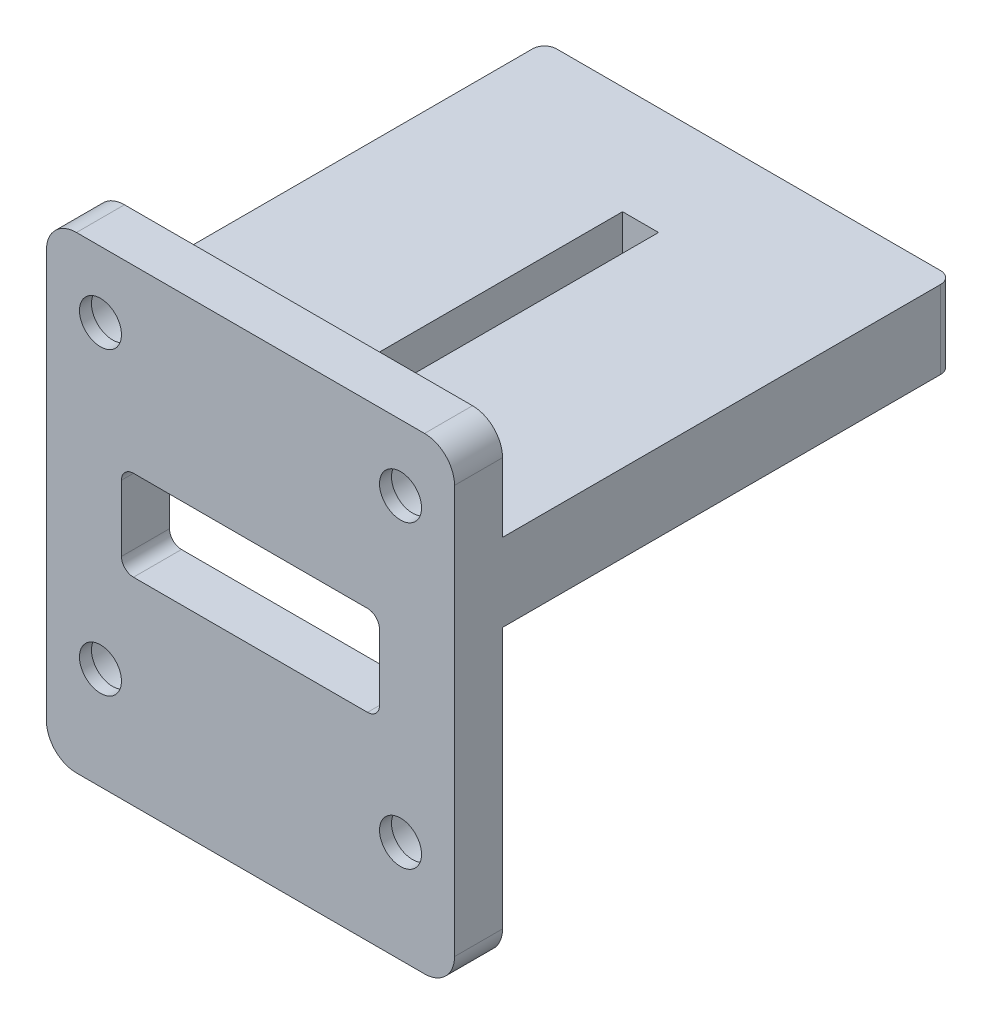
from build123d import *

# Parameters (mm, degrees)
SKETCH1_W           = 68
SKETCH1_H           = 78
BOSS_EXTRUDE1_DEPTH = 8
BOSS_EXTRUDE2_DEPTH = 75
CUT_EXTRUDE1_REACH  = 99.806
SKETCH3_W           = 43
SKETCH3_H           = 15
FILLET1_R           = 2
FILLET2_R           = 5
SKETCH4_W           = 6
SKETCH4_H           = 45
CUT_EXTRUDE2_DEPTH  = 103.777672673
SKETCH5_R           = 3.5
CUT_EXTRUDE3_DEPTH  = 92.115311556
SKETCH7_R           = 5.5
CUT_EXTRUDE4_DEPTH  = 6


with BuildPart() as part:
    # Sketch1 → Boss-Extrude1 (new body)
    with BuildSketch(Plane.XY):
        Rectangle(SKETCH1_W, SKETCH1_H)
    extrude(amount=BOSS_EXTRUDE1_DEPTH)

    # Sketch2 → Boss-Extrude2 (add)
    with BuildSketch(Plane(origin=(0, 0, 0), x_dir=(-1, 0, 0), z_dir=(0, 0, -1))):
        Polygon((-34, 22.5), (34, 22.5), (34, 9.5), (19.5, 9.5), (19.5, 15.5), (-19.5, 15.5), (-19.5, 9.5), (-34, 9.5), align=None)
    extrude(amount=BOSS_EXTRUDE2_DEPTH)

    # Sketch3 → Cut-Extrude1 (cut, up to next)
    with BuildSketch(Plane.XY.offset(8), mode=Mode.PRIVATE) as cut_extrude1_sk1:
        with Locations((0, 1.5)):
            Rectangle(SKETCH3_W, SKETCH3_H)
    cut_extrude1_tool1 = extrude(cut_extrude1_sk1.sketch, amount=-CUT_EXTRUDE1_REACH, mode=Mode.PRIVATE) & part.part
    add(cut_extrude1_tool1.solids().sort_by_distance((0, 1.5, 8))[0], mode=Mode.SUBTRACT)

    # Fillet1
    fillet1_edges = [part.edges().sort_by_distance(p)[0] for p in [
        (34, 16, -75),
        (-34, 16, -75),
        (-21.5, -6, 4),
        (-21.5, 9, 4),
        (21.5, 9, 4),
        (21.5, -6, 4),
    ]]
    fillet(fillet1_edges, radius=FILLET1_R)

    # Fillet2
    fillet2_edges = [part.edges().sort_by_distance(p)[0] for p in [
        (34, -39, 4),
        (-34, -39, 4),
        (-34, 39, 4),
        (34, 39, 4),
    ]]
    fillet(fillet2_edges, radius=FILLET2_R)

    # Sketch4 → Cut-Extrude2 (cut, through all)
    with BuildSketch(Plane(origin=(0, 22.5, 0), x_dir=(1, 0, 0), z_dir=(0, 1, 0))):
        with Locations((0, 34.5)):
            Rectangle(SKETCH4_W, SKETCH4_H)
    extrude(amount=-CUT_EXTRUDE2_DEPTH, mode=Mode.SUBTRACT)

    # Sketch5 → Cut-Extrude3 (cut, through all)
    with BuildSketch(Plane(origin=(0, 0, 0), x_dir=(-1, 0, 0), z_dir=(0, 0, -1))):
        with Locations((-25, 28)):
            Circle(SKETCH5_R)
        with Locations((25, 28)):
            Circle(SKETCH5_R)
        with Locations((-25, -22)):
            Circle(SKETCH5_R)
        with Locations((25, -22)):
            Circle(SKETCH5_R)
    extrude(amount=-CUT_EXTRUDE3_DEPTH, mode=Mode.SUBTRACT)

    # Sketch7 → Cut-Extrude4 (cut)
    with BuildSketch(Plane(origin=(0, 0, 0), x_dir=(-1, 0, 0), z_dir=(0, 0, -1))):
        with Locations((-25, 28)):
            Circle(SKETCH7_R)
        with Locations((25, 28)):
            Circle(SKETCH7_R)
        with Locations((-25, -22)):
            Circle(SKETCH7_R)
        with Locations((25, -22)):
            Circle(SKETCH7_R)
    extrude(amount=-CUT_EXTRUDE4_DEPTH, mode=Mode.SUBTRACT)


solid = part.part
